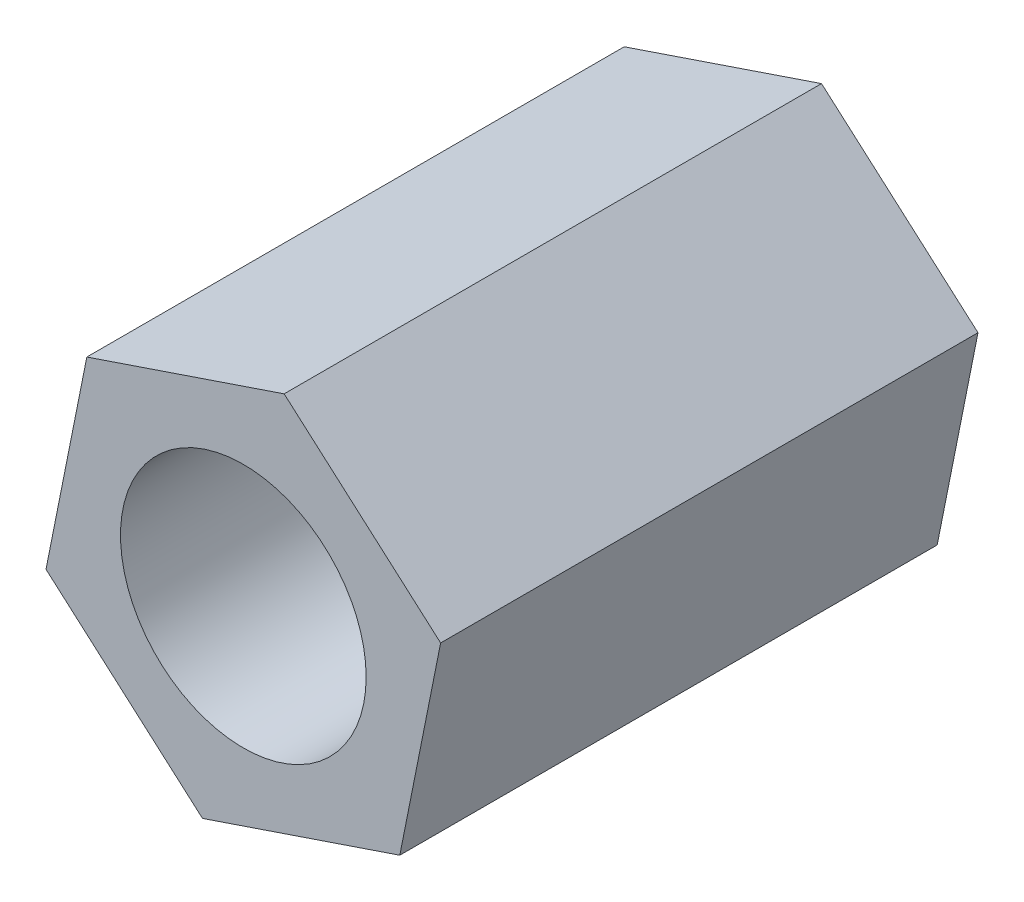
from build123d import *

# Parameters (mm, degrees)
SKETCH_1_R      = 1.6
EXTRUDE_1_DEPTH = 7


with BuildPart() as part:
    # 草图1 → 凸台-拉伸1 (new body)
    with BuildSketch(Plane.XY):
        Polygon((2.038448857, -1.79110569), (2.570367457, 0.869795649), (0.5319186, 2.660901339), (-2.038448857, 1.79110569), (-2.570367457, -0.869795649), (-0.5319186, -2.660901339), align=None)
        Circle(SKETCH_1_R, mode=Mode.SUBTRACT)
    extrude(amount=EXTRUDE_1_DEPTH)


solid = part.part
